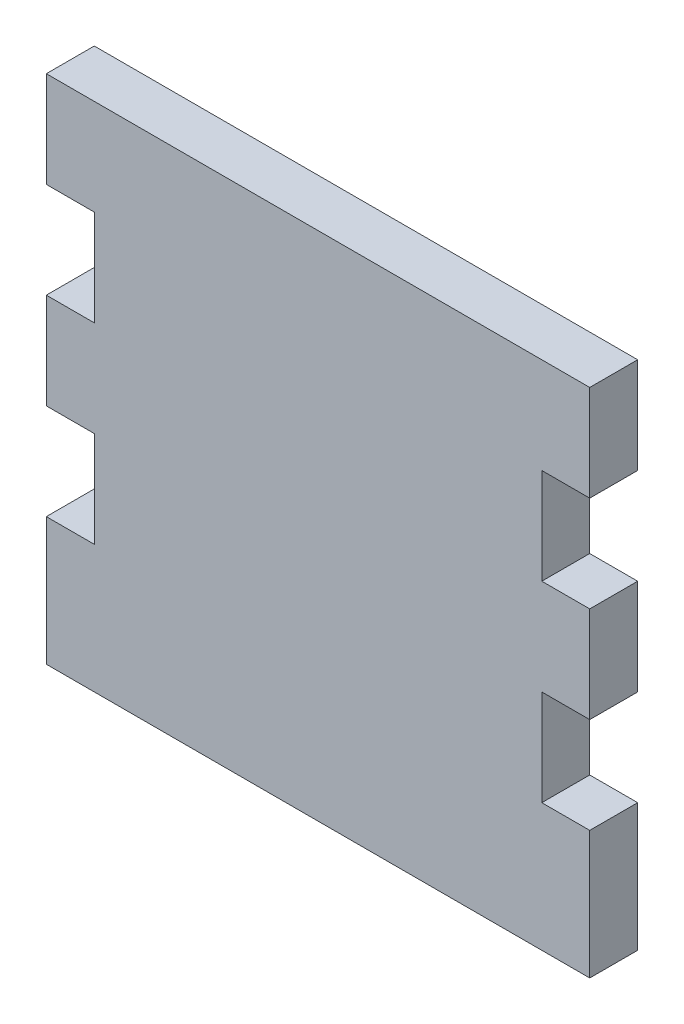
from build123d import *

# Parameters (mm, degrees)
BOSS_EXTRUDE1_DEPTH = 15


with BuildPart() as part:
    # Sketch1 → Boss-Extrude1 (new body)
    with BuildSketch(Plane.XY):
        Polygon((-397.263152268, 209.589998969), (-227.263152268, 209.589998969), (-227.263152268, 249.589998969), (-242.263152268, 249.589998969), (-242.263152268, 279.589998969), (-227.263152268, 279.589998969), (-227.263152268, 309.589998969), (-242.263152268, 309.589998969), (-242.263152268, 339.589998969), (-227.263152268, 339.589998969), (-227.263152268, 369.589998969), (-397.263152268, 369.589998969), (-397.263152268, 339.589998969), (-382.263152268, 339.589998969), (-382.263152268, 309.589998969), (-397.263152268, 309.589998969), (-397.263152268, 279.589998969), (-382.263152268, 279.589998969), (-382.263152268, 249.589998969), (-397.263152268, 249.589998969), align=None)
    extrude(amount=BOSS_EXTRUDE1_DEPTH)


solid = part.part
